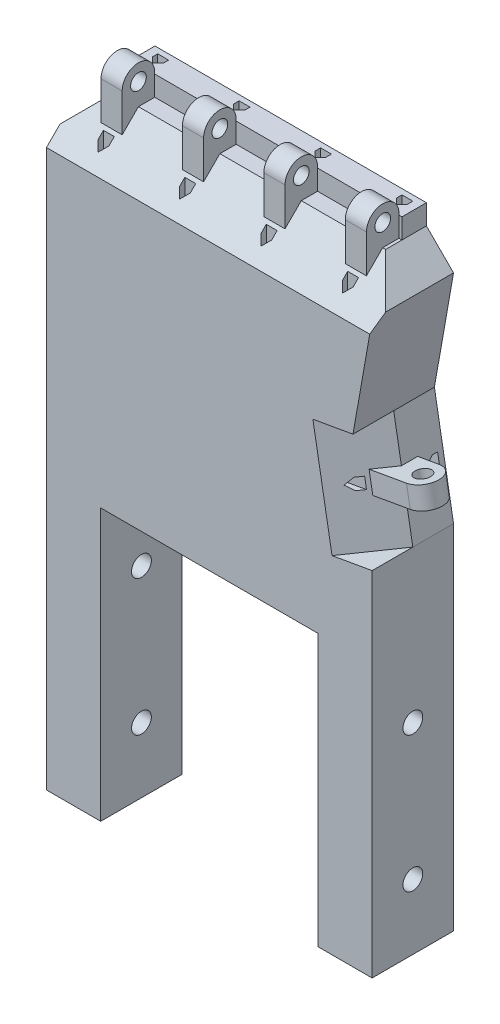
from build123d import *

# Parameters (mm, degrees)
SKETCH1_W                = 60
SKETCH1_H                = 60
BOSS_EXTRUDE1_DEPTH      = 7.5
CUT_EXTRUDE6_DEPTH       = 44.084219849
CUT_EXTRUDE6_DEPTH_BACK  = 44.084219849
SKETCH2_OUTSIDE_W        = 79.234
SKETCH2_OUTSIDE_H        = 79.234
CUT_EXTRUDE7_DEPTH       = 44.084219849
CUT_EXTRUDE7_DEPTH_BACK  = 44.084219849
SKETCH25_W               = 10
SKETCH25_H               = 15
BOSS_EXTRUDE5_DEPTH      = 50
CUT_EXTRUDE22_DEPTH      = 95.637466154
CUT_EXTRUDE22_DEPTH_BACK = 95.637466154
SKETCH26_R               = 1.825
CUT_EXTRUDE25_DEPTH      = 10.154266
CUT_EXTRUDE25_DEPTH_BACK = 10.154266
CUT_EXTRUDE29_START      = -30
CUT_EXTRUDE29_DEPTH      = 30
LPATTERN3_COUNT          = 2
LPATTERN3_PITCH          = 9
CUT_EXTRUDE32_DEPTH      = 7
SKETCH47_W               = 3.9
SKETCH47_H               = 6
BOSS_EXTRUDE6_DEPTH      = 4
SKETCH59_W               = 50
SKETCH59_H               = 4.5
BOSS_EXTRUDE8_DEPTH      = 3.7
SKETCH49_W               = 3.9
SKETCH49_H               = 3
REVOLVE2_ANGLE           = 180
LPATTERN7_COUNT          = 4
LPATTERN7_PITCH          = 15
CUT_EXTRUDE38_DEPTH      = 98.062106406
CUT_EXTRUDE38_DEPTH_BACK = 98.062106406
SKETCH50_R               = 1.45
SKETCH51_W               = 6
SKETCH51_H               = 3.9
BOSS_EXTRUDE7_DEPTH      = 4
SKETCH52_W               = 3
SKETCH52_H               = 3.9
REVOLVE4_ANGLE           = 180
SKETCH53_R               = 1.45
CUT_EXTRUDE39_DEPTH      = 3.9
CUT_EXTRUDE40_DEPTH      = 31.448531605
CUT_EXTRUDE41_DEPTH      = 24.891127074
LPATTERN8_COUNT          = 2
LPATTERN8_PITCH          = 10
LPATTERN8_COPY_1_DEPTH   = 31.448531605
LPATTERN8_COPY_2_DEPTH   = 24.891127074
FILLET1_R                = 1
CUT_EXTRUDE42_DEPTH      = 29
CUT_EXTRUDE44_DEPTH      = 3.75


with BuildPart() as part:
    # Sketch1 → Boss-Extrude1 (new, symmetric)
    with BuildSketch(Plane.XY):
        Rectangle(SKETCH1_W, SKETCH1_H)
    extrude(amount=BOSS_EXTRUDE1_DEPTH, both=True)

    # Sketch2 outside → Cut-Extrude6 (cut, two sides: drawn at the far end of the back side and taken through both)
    with BuildSketch(Plane.XY.offset(-CUT_EXTRUDE6_DEPTH_BACK)):
        Rectangle(SKETCH2_OUTSIDE_W, SKETCH2_OUTSIDE_H)
        Polygon((-30, 25), (-25, 30), (25, 30), (30, 25), (26.473460386, 5), (30, -15), (30, -30), (14.597904469, -30), (-15, -30), (-30, -30), (-30, -15), align=None, mode=Mode.SUBTRACT)
    extrude(amount=CUT_EXTRUDE6_DEPTH + CUT_EXTRUDE6_DEPTH_BACK, mode=Mode.SUBTRACT)

    # Sketch9 → Cut-Extrude7 (cut, two sides: drawn at the far end of the back side and taken through both)
    with BuildSketch(Plane(origin=(0, 0, 0), x_dir=(0, 0, -1), z_dir=(1, 0, 0)).offset(-CUT_EXTRUDE7_DEPTH_BACK)):
        Polygon((-7.5, 30), (0, 30), (-7.5, 22.5), align=None)
    extrude(amount=CUT_EXTRUDE7_DEPTH + CUT_EXTRUDE7_DEPTH_BACK, mode=Mode.SUBTRACT)

    # Sketch25 → Boss-Extrude5 (add)
    with BuildSketch(Plane.XZ.offset(30)):
        with Locations((-25, 0)):
            Rectangle(SKETCH25_W, SKETCH25_H)
        with Locations((25, 0)):
            Rectangle(SKETCH25_W, SKETCH25_H)
    extrude(amount=BOSS_EXTRUDE5_DEPTH)

    # Sketch26 → Cut-Extrude22 (cut, two sides: drawn at the far end of the back side and taken through both)
    with BuildSketch(Plane(origin=(-20, 0, 0), x_dir=(0, 0, -1), z_dir=(1, 0, 0)).offset(-CUT_EXTRUDE22_DEPTH_BACK)):
        with Locations((0, -68)):
            Circle(SKETCH26_R)
        with Locations((0, -43)):
            Circle(SKETCH26_R)
    extrude(amount=CUT_EXTRUDE22_DEPTH + CUT_EXTRUDE22_DEPTH_BACK, mode=Mode.SUBTRACT)

    # Sketch31 → Cut-Extrude25 (cut, two sides: drawn at the far end of the back side and taken through both)
    with BuildSketch(Plane(origin=(1.706491956, -9.677996806, 0), x_dir=(0.9848077530122091, 0.17364817766692411, 0), z_dir=(-0.17364817766692414, 0.9848077530122092, 0)).offset(-CUT_EXTRUDE25_DEPTH_BACK)):
        Polygon((26.939509925, -7.5), (19.439509925, -7.5), (26.939509925, 0), align=None)
    extrude(amount=CUT_EXTRUDE25_DEPTH + CUT_EXTRUDE25_DEPTH_BACK, mode=Mode.SUBTRACT)

    # Sketch36 → Cut-Extrude29 (cut)
    with BuildSketch(Plane.XZ.offset(30).offset(CUT_EXTRUDE29_START)):
        Polygon((0, 6.5), (-2, 4.5), (-2, 2.5), (2, 2.5), (2, 4.5), align=None)
    cut_extrude29 = extrude(amount=CUT_EXTRUDE29_DEPTH, mode=Mode.SUBTRACT)

    # LPattern3: Cut-Extrude29 ×2
    with Locations(*[(0, 0, -i * LPATTERN3_PITCH) for i in range(1, LPATTERN3_COUNT)]):
        add(cut_extrude29, mode=Mode.SUBTRACT)

    # Sketch41 → Cut-Extrude32 (cut)
    with BuildSketch(Plane(origin=(0, 30, 0), x_dir=(1, 0, 0), z_dir=(0, 1, 0))):
        Polygon((-23.5, 6.5), (-21.5, 6.5), (-21.5, 5.5), (-22.5, 4.5), (-23.5, 5.5), align=None)
        Polygon((-8.5, 5.5), (-8.5, 6.5), (-6.5, 6.5), (-6.5, 5.5), (-7.5, 4.5), align=None)
        Polygon((6.5, 5.5), (6.5, 6.5), (8.5, 6.5), (8.5, 5.5), (7.5, 4.5), align=None)
        Polygon((21.5, 5.5), (21.5, 6.5), (23.5, 6.5), (23.5, 5.5), (22.5, 4.5), align=None)
        Polygon((-8.5, -4.5), (-8.5, -3.5), (-6.5, -3.5), (-6.5, -4.5), (-7.5, -5.5), align=None)
        Polygon((6.5, -4.5), (6.5, -3.5), (8.5, -3.5), (8.5, -4.5), (7.5, -5.5), align=None)
        Polygon((21.5, -4.5), (21.5, -3.5), (23.5, -3.5), (23.5, -4.5), (22.5, -5.5), align=None)
        Polygon((-23.5, -4.5), (-23.5, -3.5), (-21.5, -3.5), (-21.5, -4.5), (-22.5, -5.5), align=None)
    extrude(amount=-CUT_EXTRUDE32_DEPTH, mode=Mode.SUBTRACT)

    # Sketch47 → Boss-Extrude6 (add, symmetric)
    with BuildSketch(Plane(origin=(0, 30, 0), x_dir=(1, 0, 0), z_dir=(0, 1, 0))):
        with Locations((-22.5, 0)):
            Rectangle(SKETCH47_W, SKETCH47_H)
        with Locations((-7.5, 0)):
            Rectangle(SKETCH47_W, SKETCH47_H)
        with Locations((7.5, 0)):
            Rectangle(SKETCH47_W, SKETCH47_H)
        with Locations((22.5, 0)):
            Rectangle(SKETCH47_W, SKETCH47_H)
    extrude(amount=BOSS_EXTRUDE6_DEPTH, both=True)

    # Sketch59 → Boss-Extrude8 (add)
    with BuildSketch(Plane(origin=(0, 30, 0), x_dir=(1, 0, 0), z_dir=(0, 1, 0))):
        with Locations((0, 5.25)):
            Rectangle(SKETCH59_W, SKETCH59_H)
    extrude(amount=BOSS_EXTRUDE8_DEPTH)

    # Sketch49 → Revolve2 (revolve)
    with BuildSketch(Plane(origin=(0, 34, 0), x_dir=(1, 0, 0), z_dir=(0, 1, 0))):
        with Locations((-22.5, 1.5)):
            Rectangle(SKETCH49_W, SKETCH49_H)
    revolve2 = revolve(axis=Axis((-24.45, 34, 0), (1, 0, 0)), revolution_arc=REVOLVE2_ANGLE)

    # LPattern7: Revolve2 ×4
    with Locations(*[(i * LPATTERN7_PITCH, 0, 0) for i in range(1, LPATTERN7_COUNT)]):
        add(revolve2)

    # Sketch50 → Cut-Extrude38 (cut, two sides: drawn at the far end of the back side and taken through both)
    with BuildSketch(Plane.ZY.offset(24.45).offset(-CUT_EXTRUDE38_DEPTH_BACK)):
        with Locations((0, 34)):
            Circle(SKETCH50_R)
    extrude(amount=CUT_EXTRUDE38_DEPTH + CUT_EXTRUDE38_DEPTH_BACK, mode=Mode.SUBTRACT)

    # Sketch51 → Boss-Extrude7 (add, symmetric)
    with BuildSketch(Plane(origin=(26.530238237, 4.677996806, 0), x_dir=(0, 0, -1), z_dir=(0.9848077530122092, 0.17364817766692414, 0))):
        with Locations((0, -9.827295506)):
            Rectangle(SKETCH51_W, SKETCH51_H)
    extrude(amount=BOSS_EXTRUDE7_DEPTH, both=True)

    # Sketch52 → Revolve4 (revolve)
    with BuildSketch(Plane(origin=(30.469469249, 5.372589516, 0), x_dir=(0, 0, -1), z_dir=(0.9848077530122092, 0.17364817766692361, 0))):
        with Locations((1.5, -9.827295506)):
            Rectangle(SKETCH52_W, SKETCH52_H)
    revolve(axis=Axis((32.514575151, -6.225782408, 0), (0.1736481776669235, -0.9848077530122092, 0)), revolution_arc=REVOLVE4_ANGLE)

    # Sketch53 → Cut-Extrude39 (cut)
    with BuildSketch(Plane(origin=(1.36787801, -7.757621687, 0), x_dir=(0.9848077530122091, 0.17364817766692411, 0), z_dir=(-0.17364817766692414, 0.9848077530122092, 0))):
        with Locations(Location((30.939509925, 0, 0), (0, 0, 180))):
            Circle(SKETCH53_R)
    extrude(amount=-CUT_EXTRUDE39_DEPTH, mode=Mode.SUBTRACT)

    # Sketch56 → Cut-Extrude40 (cut, along a direction that is not the sketch's normal)
    with BuildSketch(Plane(origin=(0, 23, 0), x_dir=(1, 0, 0), z_dir=(0, 1, 0))):
        Polygon((-22.5, -5.5), (-21.5, -4.5), (-21.5, -3.5), (-23.5, -3.5), (-23.5, -4.5), align=None)
    cut_extrude40 = extrude(amount=-CUT_EXTRUDE40_DEPTH, dir=(-0.6819983600624921, 0.7313537016191766, 0), mode=Mode.SUBTRACT)

    # Sketch57 → Cut-Extrude41 (cut, along a direction that is not the sketch's normal)
    with BuildSketch(Plane(origin=(0, 23, 0), x_dir=(1, 0, 0), z_dir=(0, 1, 0))):
        Polygon((-7.5, -5.5), (-8.5, -4.5), (-8.5, -3.5), (-6.5, -3.5), (-6.5, -4.5), align=None)
    cut_extrude41 = extrude(amount=-CUT_EXTRUDE41_DEPTH, dir=(-0.2756373558169998, 0.9612616959383187, 0), mode=Mode.SUBTRACT)

    # Mirror1: Cut-Extrude40, Cut-Extrude41 across plane
    add(cut_extrude40.mirror(Plane(origin=(0, 0, 0), x_dir=(0, 0, 1), z_dir=(1, 0, 0))), mode=Mode.SUBTRACT)
    add(cut_extrude41.mirror(Plane(origin=(0, 0, 0), x_dir=(0, 0, 1), z_dir=(1, 0, 0))), mode=Mode.SUBTRACT)

    # LPattern8: Cut-Extrude40, Cut-Extrude41 ×2
    with Locations(*[(0, 0, -i * LPATTERN8_PITCH) for i in range(1, LPATTERN8_COUNT)]):
        add(cut_extrude40, mode=Mode.SUBTRACT)
        add(cut_extrude41, mode=Mode.SUBTRACT)

    # LPattern8 copy 1 sketch → LPattern8 copy 1 (cut, along a direction that is not the sketch's normal)
    with BuildSketch(Plane(origin=(0, 23, -10), x_dir=(-1, 0, 0), z_dir=(0, 1, 0))):
        Polygon((-22.5, 5.5), (-21.5, 4.5), (-21.5, 3.5), (-23.5, 3.5), (-23.5, 4.5), align=None)
    extrude(amount=-LPATTERN8_COPY_1_DEPTH, dir=(0.6819983600624921, 0.7313537016191766, 0), mode=Mode.SUBTRACT)

    # LPattern8 copy 2 sketch → LPattern8 copy 2 (cut, along a direction that is not the sketch's normal)
    with BuildSketch(Plane(origin=(0, 23, -10), x_dir=(-1, 0, 0), z_dir=(0, 1, 0))):
        Polygon((-7.5, 5.5), (-8.5, 4.5), (-8.5, 3.5), (-6.5, 3.5), (-6.5, 4.5), align=None)
    extrude(amount=-LPATTERN8_COPY_2_DEPTH, dir=(0.2756373558169998, 0.9612616959383187, 0), mode=Mode.SUBTRACT)

    # Fillet1
    fillet1_edges = [part.edges().sort_by_distance(p)[0] for p in [
        (-6.5, 23, 4),
        (-8.5, 23, 4),
        (23.5, 23, -6),
        (21.5, 23, -6),
        (8.5, 23, -6),
        (6.5, 23, -6),
        (-6.5, 23, -6),
        (-8.5, 23, -6),
        (8.5, 23, 4),
        (6.5, 23, 4),
        (23.5, 23, 4),
        (21.5, 23, 4),
        (-21.5, 23, 4),
        (-23.5, 23, 4),
        (-23.5, 23, -6),
        (-21.5, 23, -6),
    ]]
    fillet(fillet1_edges, radius=FILLET1_R)

    # Sketch58 → Cut-Extrude42 (cut)
    with BuildSketch(Plane(origin=(26.530238237, 4.677996806, 0), x_dir=(0, 0, -1), z_dir=(0.9848077530122092, 0.17364817766692414, 0))):
        Polygon((6.5, -10.827295506), (6.5, -8.827295506), (5.5, -8.827295506), (4.5, -9.827295506), (5.5, -10.827295506), align=None)
        Polygon((-4.5, -10.827295506), (-3.5, -10.827295506), (-3.5, -8.827295506), (-4.5, -8.827295506), (-5.5, -9.827295506), align=None)
    extrude(amount=-CUT_EXTRUDE42_DEPTH, mode=Mode.SUBTRACT)

    # Sketch60 → Cut-Extrude44 (cut)
    with BuildSketch(Plane(origin=(0, 33.7, 0), x_dir=(1, 0, 0), z_dir=(0, 1, 0))):
        Polygon((-23.5, 6.5), (-21.5, 6.5), (-21.5, 5.5), (-22.5, 4.5), (-23.5, 5.5), align=None)
        Polygon((-8.5, 5.5), (-8.5, 6.5), (-6.5, 6.5), (-6.5, 5.5), (-7.5, 4.5), align=None)
        Polygon((6.5, 5.5), (6.5, 6.5), (8.5, 6.5), (8.5, 5.5), (7.5, 4.5), align=None)
        Polygon((21.5, 5.5), (21.5, 6.5), (23.5, 6.5), (23.5, 5.5), (22.5, 4.5), align=None)
    extrude(amount=-CUT_EXTRUDE44_DEPTH, mode=Mode.SUBTRACT)


solid = part.part
